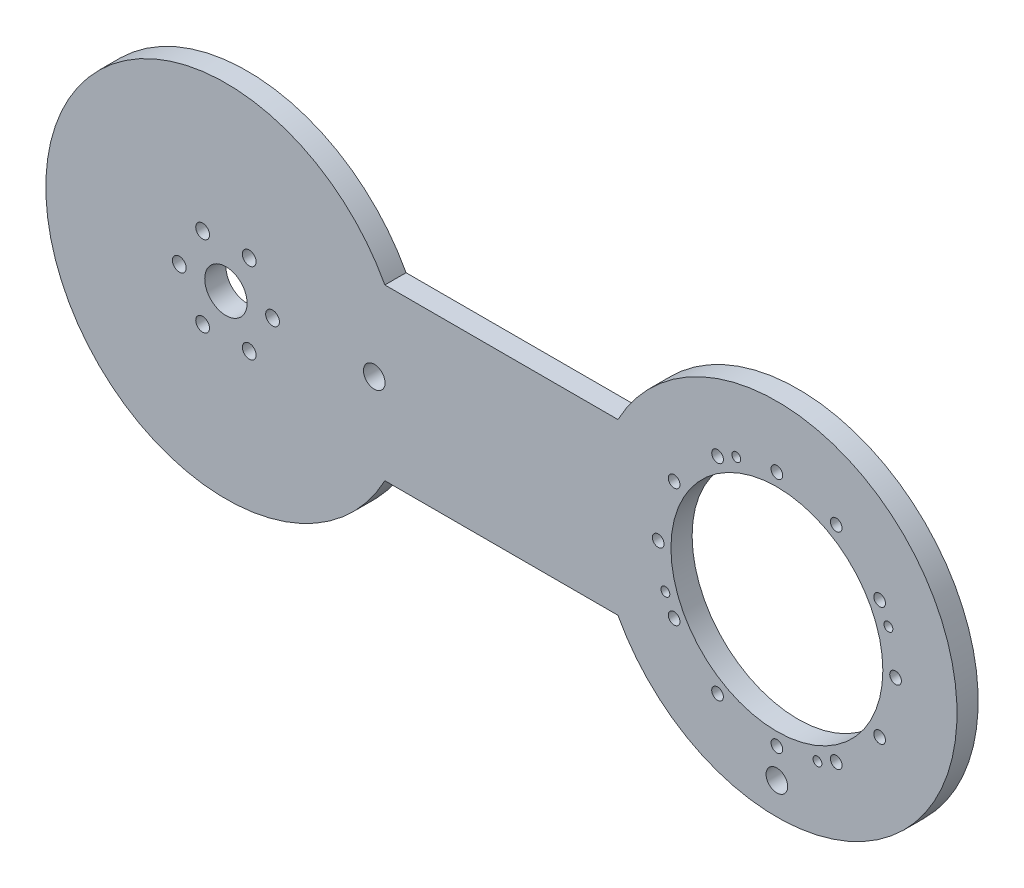
from build123d import *

# Parameters (mm, degrees)
SKETCH_1_R          = 85
EXTRUDE_1_DEPTH     = 10
SKETCH_2_W          = 260
SKETCH_2_H          = 80
EXTRUDE_2_DEPTH     = 10
SKETCH_3_R          = 85
EXTRUDE_3_DEPTH     = 10
SKETCH_4_R          = 10
SKETCH_4_R_2        = 3.25
SKETCH_4_R_3        = 50
SKETCH_4_R_4        = 2.75
SKETCH_4_R_5        = 2.1
SKETCH_4_R_6        = 5.1
CUT_EXTRUDE_1_DEPTH = 11


with BuildPart() as part:
    # 草图1 → 凸台-拉伸1 (new body)
    with BuildSketch(Plane.XY):
        Circle(SKETCH_1_R)
    extrude(amount=EXTRUDE_1_DEPTH)

    # 草图2 → 凸台-拉伸2 (add)
    with BuildSketch(Plane.XY):
        with Locations((130, 0)):
            Rectangle(SKETCH_2_W, SKETCH_2_H)
    extrude(amount=EXTRUDE_2_DEPTH)

    # 草图3 → 凸台-拉伸3 (add)
    with BuildSketch(Plane.XY):
        with Locations((260, 0)):
            Circle(SKETCH_3_R)
    extrude(amount=EXTRUDE_3_DEPTH)

    # 草图4 → 切除-拉伸1 (cut)
    with BuildSketch(Plane(origin=(0, 0, 0), x_dir=(-1, 0, 0), z_dir=(0, 0, -1))):
        Circle(SKETCH_4_R)
        with Locations((-22, 0)):
            Circle(SKETCH_4_R_2)
        with Locations((-11, 19.052558883)):
            Circle(SKETCH_4_R_2)
        with Locations((11, 19.052558883)):
            Circle(SKETCH_4_R_2)
        with Locations((22, 0)):
            Circle(SKETCH_4_R_2)
        with Locations((11, -19.052558883)):
            Circle(SKETCH_4_R_2)
        with Locations((-11, -19.052558883)):
            Circle(SKETCH_4_R_2)
        with Locations((-260, 0)):
            Circle(SKETCH_4_R_3)
        with Locations((-316, 0)):
            Circle(SKETCH_4_R_4)
        with Locations((-308.497422612, 28)):
            Circle(SKETCH_4_R_4)
        with Locations((-288, 48.497422612)):
            Circle(SKETCH_4_R_4)
        with Locations((-260, 56)):
            Circle(SKETCH_4_R_4)
        with Locations((-232, 48.497422612)):
            Circle(SKETCH_4_R_4)
        with Locations((-211.502577388, 28)):
            Circle(SKETCH_4_R_4)
        with Locations((-204, 0)):
            Circle(SKETCH_4_R_4)
        with Locations((-211.502577388, -28)):
            Circle(SKETCH_4_R_4)
        with Locations((-232, -48.497422612)):
            Circle(SKETCH_4_R_4)
        with Locations((-260, -56)):
            Circle(SKETCH_4_R_4)
        with Locations((-288, -48.497422612)):
            Circle(SKETCH_4_R_4)
        with Locations((-308.497422612, -28)):
            Circle(SKETCH_4_R_4)
        with Locations((-312.622786764, 19.153128026)):
            Circle(SKETCH_4_R_5)
        with Locations((-240.846871974, 52.622786764)):
            Circle(SKETCH_4_R_5)
        with Locations((-207.377213236, -19.153128026)):
            Circle(SKETCH_4_R_5)
        with Locations((-279.153128026, -52.622786764)):
            Circle(SKETCH_4_R_5)
        with Locations((-70, 0)):
            Circle(SKETCH_4_R_6)
        with Locations((-260, -70)):
            Circle(SKETCH_4_R_6)
    extrude(amount=-CUT_EXTRUDE_1_DEPTH, mode=Mode.SUBTRACT)


solid = part.part
